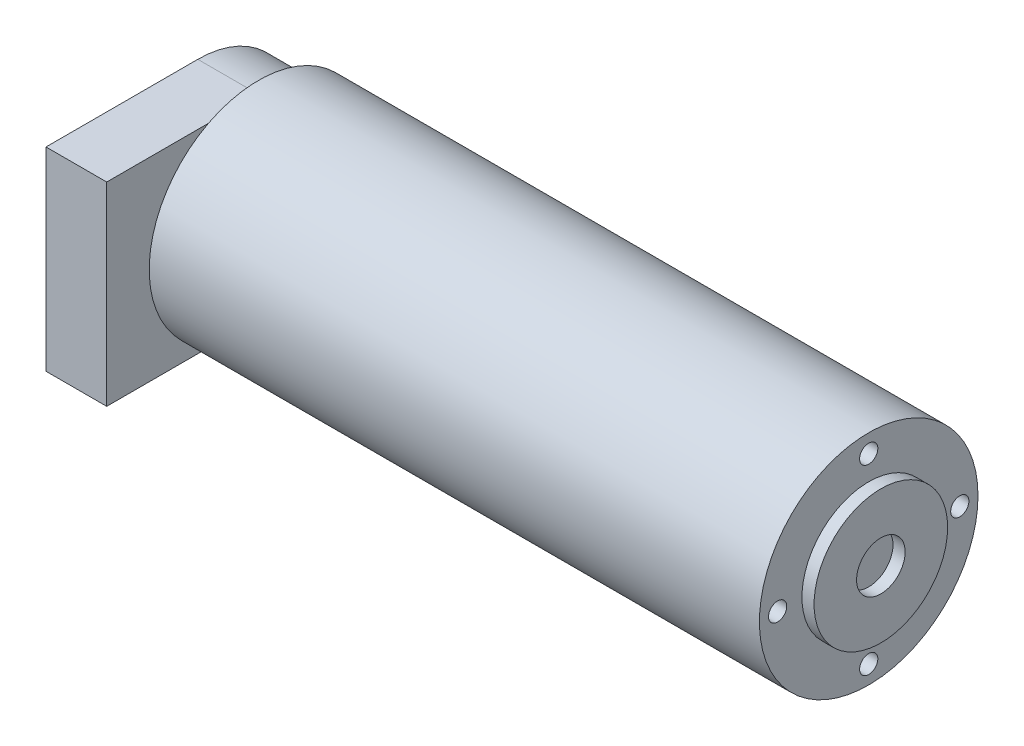
from build123d import *

# Parameters (mm, degrees)
SKETCH_2_R           = 18
EXTRUDE_1_DEPTH      = 110.5
SKETCH_3_R           = 11
EXTRUDE_2_DEPTH      = 2
SKETCH_4_R           = 4
EXTRUDE_3_DEPTH      = 15
SKETCH_5_R           = 16
SKETCH_5_W           = 25
SKETCH_5_H           = 32
EXTRUDE_4_DEPTH      = 19
CUT_EXTRUDE_START    = -17
SKETCH_6_R           = 4
CUT_EXTRUDE_2_DEPTH  = 17
SKETCH_8_R           = 1.5
CUT_EXTRUDE_3_DEPTH  = 8
SKETCH_9_W           = 7
SKETCH_9_H           = 53.664009665
CUT_EXTRUDE_4_DEPTH  = 121.15510809
SKETCH_10_W          = 2
SKETCH_10_H          = 52.133274579
CUT_EXTRUDE_6_DEPTH  = 121.15510809
EXTRUDE_START        = -20
EXTRUDE_5_DEPTH      = 20
SKETCH_12_R          = 18
SKETCH_12_R_2        = 16
CUT_EXTRUDE_7_DEPTH  = 20
SKETCH_13_W          = 25
SKETCH_13_H          = 32
EXTRUDE_6_DEPTH      = 20
SKETCH_14_W          = 10
SKETCH_14_H          = 32
CUT_EXTRUDE_8_DEPTH  = 122.775408026
SKETCH_15_R          = 18
CUT_EXTRUDE_10_DEPTH = 10
SKETCH_16_R          = 16
EXTRUDE_7_DEPTH      = 10
SKETCH_17_W          = 25
SKETCH_17_H          = 32
EXTRUDE_8_DEPTH      = 10


with BuildPart() as part:
    # 草图2 → 凸台-拉伸1 (new body)
    with BuildSketch(Plane(origin=(0, 0, 0), x_dir=(0, 0, -1), z_dir=(1, 0, 0))):
        Circle(SKETCH_2_R)
    extrude(amount=EXTRUDE_1_DEPTH)

    # 草图3 → 凸台-拉伸2 (add)
    with BuildSketch(Plane(origin=(110.5, 0, 0), x_dir=(0, 0, -1), z_dir=(1, 0, 0))):
        Circle(SKETCH_3_R)
    extrude(amount=EXTRUDE_2_DEPTH)

    # 草图4 → 凸台-拉伸3 (add)
    with BuildSketch(Plane(origin=(112.5, 0, 0), x_dir=(0, 0, -1), z_dir=(1, 0, 0))):
        Circle(SKETCH_4_R)
    extrude(amount=EXTRUDE_3_DEPTH)

    # 草图5 → 凸台-拉伸4 (add)
    with BuildSketch(Plane.ZY):
        Circle(SKETCH_5_R)
        with Locations((12.5, 0)):
            Rectangle(SKETCH_5_W, SKETCH_5_H)
    extrude(amount=EXTRUDE_4_DEPTH)

    # 草图6 → 切除-拉伸2 (cut)
    with BuildSketch(Plane(origin=(127.5, 0, 0), x_dir=(0, 0, -1), z_dir=(1, 0, 0)).offset(CUT_EXTRUDE_START)):
        Circle(SKETCH_6_R)
    extrude(amount=CUT_EXTRUDE_2_DEPTH, mode=Mode.SUBTRACT)

    # 草图8 → 切除-拉伸3 (cut)
    with BuildSketch(Plane(origin=(110.5, 0, 0), x_dir=(0, 0, -1), z_dir=(1, 0, 0))):
        with Locations((0, 15)):
            Circle(SKETCH_8_R)
        with Locations((15, 0)):
            Circle(SKETCH_8_R)
        with Locations((0, -15)):
            Circle(SKETCH_8_R)
        with Locations((-15, 0)):
            Circle(SKETCH_8_R)
    extrude(amount=-CUT_EXTRUDE_3_DEPTH, mode=Mode.SUBTRACT)

    # 草图9 → 切除-拉伸4 (cut, through all)
    with BuildSketch(Plane.XZ.offset(16)):
        with Locations((-15.5, -1.832004833)):
            Rectangle(SKETCH_9_W, SKETCH_9_H)
    extrude(amount=-CUT_EXTRUDE_4_DEPTH, mode=Mode.SUBTRACT)

    # 草图10 → 切除-拉伸6 (cut, through all)
    with BuildSketch(Plane.XZ.offset(16)):
        with Locations((-11, -1.06663729)):
            Rectangle(SKETCH_10_W, SKETCH_10_H)
    extrude(amount=-CUT_EXTRUDE_6_DEPTH, mode=Mode.SUBTRACT)

    # 草图11 → 凸台-拉伸5 (add)
    with BuildSketch(Plane.ZY.offset(10).offset(EXTRUDE_START)):
        with BuildLine():
            Line((25, -16), (25, 16))
            Line((25, 16), (0, 16))
            ThreePointArc((0, 16), (11.313708499, 11.313708499), (16, 0))
            ThreePointArc((16, 0), (11.313708499, -11.313708499), (0, -16))
            Line((0, -16), (25, -16))
        make_face()
        with BuildLine():
            Line((0, 16), (0, -16))
            ThreePointArc((0, -16), (-16, 0), (0, 16))
        make_face()
        with BuildLine():
            ThreePointArc((16, 0), (11.313708499, 11.313708499), (0, 16))
            Line((0, 16), (0, -16))
            ThreePointArc((0, -16), (11.313708499, -11.313708499), (16, 0))
        make_face()
        with BuildLine():
            Line((0, -16), (0, 16))
            ThreePointArc((0, 16), (-16, 0), (0, -16))
        make_face()
    extrude(amount=EXTRUDE_5_DEPTH)

    # 草图12 → 切除-拉伸7 (cut)
    with BuildSketch(Plane.ZY):
        with Locations(Location((0, 0, 0), (0, 0, 62.733955549))):
            Circle(SKETCH_12_R)
        Circle(SKETCH_12_R_2, mode=Mode.SUBTRACT)
    extrude(amount=CUT_EXTRUDE_7_DEPTH, mode=Mode.SUBTRACT)

    # 草图13 → 凸台-拉伸6 (add)
    with BuildSketch(Plane.ZY.offset(10)):
        with Locations((12.5, 0)):
            Rectangle(SKETCH_13_W, SKETCH_13_H)
    extrude(amount=-EXTRUDE_6_DEPTH)

    # 草图14 → 切除-拉伸8 (cut, through all)
    with BuildSketch(Plane.XY.offset(25)):
        with Locations((-5, 0)):
            Rectangle(SKETCH_14_W, SKETCH_14_H)
    extrude(amount=-CUT_EXTRUDE_8_DEPTH, mode=Mode.SUBTRACT)

    # 草图15 → 切除-拉伸10 (cut)
    with BuildSketch(Plane.ZY):
        Circle(SKETCH_15_R)
    extrude(amount=-CUT_EXTRUDE_10_DEPTH, mode=Mode.SUBTRACT)


with BuildPart() as cut_extrude_10_piece_1:
    # of the separate pieces the step leaves, piece 1, a body of its own (cut_extrude_10_pieces)
    add(part.part.solids().sort_by_distance((10, 0, -18))[0])

    # 草图16 → 凸台-拉伸7 (add)
    with BuildSketch(Plane.ZY.offset(-10)):
        Circle(SKETCH_16_R)
    extrude(amount=EXTRUDE_7_DEPTH)



with BuildPart() as cut_extrude_10_piece_2:
    # of the separate pieces the step leaves, piece 2, a body of its own (cut_extrude_10_pieces)
    add(part.part.solids().sort_by_distance((10, 16, 25))[0])


with BuildPart() as cut_extrude_10_piece_1_1:
    add(cut_extrude_10_piece_1.part)

    add(cut_extrude_10_piece_2.part)  # 凸台-拉伸8 merges 切除-拉伸10 piece 2
    # 草图17 → 凸台-拉伸8 (add)
    with BuildSketch(Plane.ZY):
        with Locations((12.5, 0)):
            Rectangle(SKETCH_17_W, SKETCH_17_H)
    extrude(amount=-EXTRUDE_8_DEPTH)


solid = cut_extrude_10_piece_1_1.part
